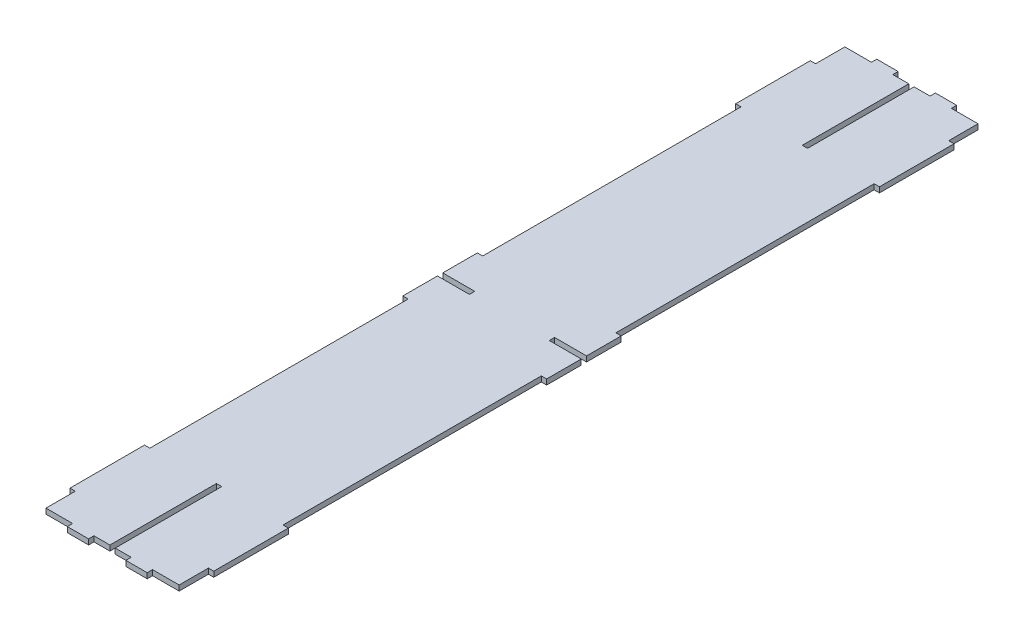
from build123d import *

# Parameters (mm, degrees)
BOSS_EXTRUDE1_DEPTH = 1


with BuildPart() as part:
    # Sketch1 → Boss-Extrude1 (new body)
    with BuildSketch(Plane(origin=(0, 0, 0), x_dir=(1, 0, 0), z_dir=(0, 1, 0))):
        Polygon((-12.5, 75), (-7.5, 75), (-7.5, 76), (-3.5, 76), (-3.5, 75), (-0.5, 75), (-0.5, 55), (0.5, 55), (0.5, 75), (3.5, 75), (3.5, 76), (7.5, 76), (7.5, 75), (12.5, 75), (12.5, 69.5), (13.5, 69.5), (13.5, 55.5), (12.5, 55.5), (12.5, 7), (13.5, 7), (13.5, 0.5), (7.5, 0.5), (7.5, -0.5), (13.5, -0.5), (13.5, -7), (12.5, -7), (12.5, -55.5), (13.5, -55.5), (13.5, -69.5), (12.5, -69.5), (12.5, -75), (7.5, -75), (7.5, -76), (3.5, -76), (3.5, -75), (0.5, -75), (0.5, -55), (-0.5, -55), (-0.5, -75), (-3.5, -75), (-3.5, -76), (-7.5, -76), (-7.5, -75), (-12.5, -75), (-12.5, -69.5), (-13.5, -69.5), (-13.5, -55.5), (-12.5, -55.5), (-12.5, -7), (-13.5, -7), (-13.5, -0.5), (-7.5, -0.5), (-7.5, 0.5), (-13.5, 0.5), (-13.5, 7), (-12.5, 7), (-12.5, 55.5), (-13.5, 55.5), (-13.5, 69.5), (-12.5, 69.5), align=None)
    extrude(amount=BOSS_EXTRUDE1_DEPTH)


solid = part.part
